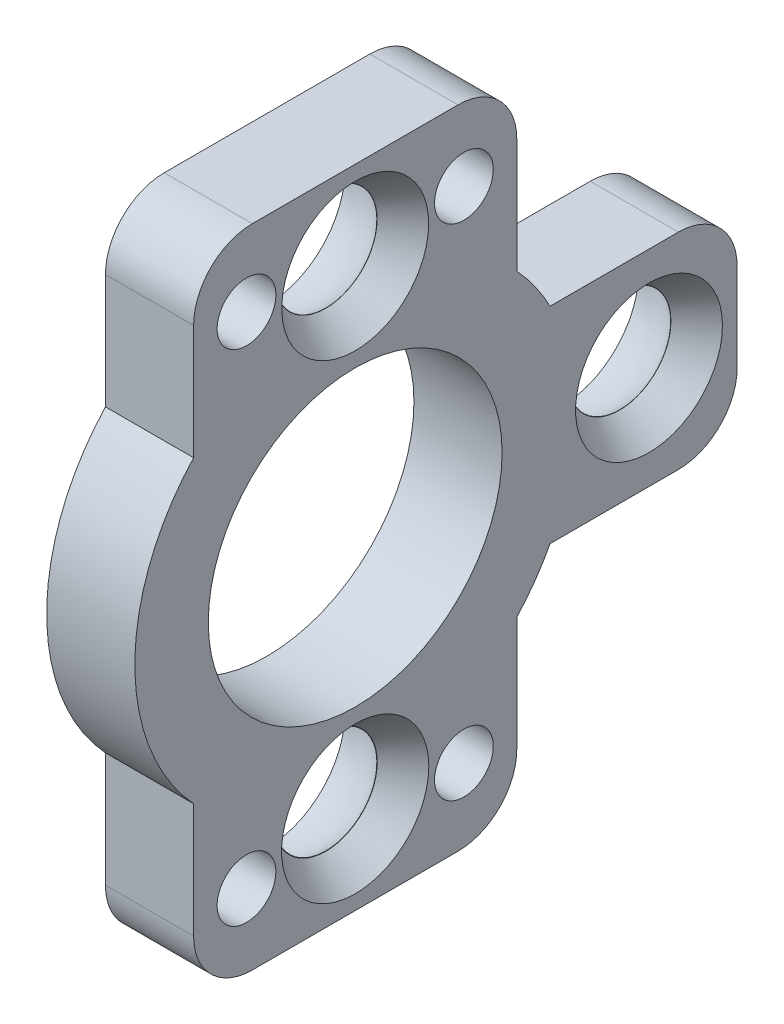
from build123d import *

# Parameters (mm, degrees)
SKETCH_1_R                    = 7.5
SKETCH_1_R_2                  = 5
EXTRUDE_1_DEPTH               = 3
SKETCH_2_W                    = 11
SKETCH_2_H                    = 6
EXTRUDE_2_DEPTH               = 3
SKETCH_5_R                    = 2.5
CUT_EXTRUDE_1_DEPTH           = 1
CUT_EXTRUDE_1_DRAFT           = -37
SKETCH_5_R_2                  = 2.505592327
CUT_EXTRUDE_1_PROFILE_2_DEPTH = 1
CUT_EXTRUDE_1_PROFILE_2_DRAFT = -37
FILLET_2_R                    = 2
SKETCH_7_R                    = 1
CUT_EXTRUDE_3_DEPTH           = 14.647344064
SKETCH_8_W                    = 7.5
SKETCH_8_H                    = 7
EXTRUDE_3_DEPTH               = 3
SKETCH_10_R                   = 2.5
CUT_EXTRUDE_4_DEPTH           = 1
CUT_EXTRUDE_4_DRAFT           = -37
FILLET_3_R                    = 2


with BuildPart() as part:
    # 草图1 → 凸台-拉伸1 (new body)
    with BuildSketch(Plane(origin=(0, 0, 0), x_dir=(0, 0, -1), z_dir=(1, 0, 0))):
        Circle(SKETCH_1_R)
        Circle(SKETCH_1_R_2, mode=Mode.SUBTRACT)
    extrude(amount=EXTRUDE_1_DEPTH)

    # 草图2 → 凸台-拉伸2 (add)
    with BuildSketch(Plane(origin=(3, 0, 0), x_dir=(0, 0, -1), z_dir=(1, 0, 0))):
        with Locations((0, 8)):
            Rectangle(SKETCH_2_W, SKETCH_2_H)
        with Locations((0, -8)):
            Rectangle(SKETCH_2_W, SKETCH_2_H)
    extrude(amount=-EXTRUDE_2_DEPTH)

    # 草图3 → 切除-旋转1 (revolve, cut)
    with BuildSketch(Plane.ZY):
        with BuildLine():
            Line((-2.65, 8), (2.65, 8))
            ThreePointArc((2.65, 8), (0, 5.35), (-2.65, 8))
        make_face()
    revolve(axis=Axis((0, 8, -2.65), (0, 0, 1)), mode=Mode.SUBTRACT)

    # 草图4 → 切除-旋转2 (revolve, cut)
    with BuildSketch(Plane.ZY):
        with BuildLine():
            Line((2.65, -8), (-2.65, -8))
            ThreePointArc((-2.65, -8), (0, -10.65), (2.65, -8))
        make_face()
    revolve(axis=Axis((0, -8, 2.65), (0, 0, -1)), mode=Mode.SUBTRACT)


with BuildPart() as cut_extrude_1_tool:
    # 草图5 → 切除-拉伸1 (with draft: the straight prism first)
    with BuildSketch(Plane(origin=(3, 0, 0), x_dir=(0, 0, -1), z_dir=(1, 0, 0))):
        with Locations((0, 8)):
            Circle(SKETCH_5_R)
    extrude(amount=-CUT_EXTRUDE_1_DEPTH)
    # 切除-拉伸1: the draft: its side faces are tilted about the plane it starts from
    cut_extrude_1_sides = [cut_extrude_1_tool.faces().sort_by_distance(p)[0] for p in [
        (2.5, 8, 2.5),
    ]]
    draft(cut_extrude_1_sides, Plane(origin=(3, 0, 0), x_dir=(0, 0, -1), z_dir=(1, 0, 0)), CUT_EXTRUDE_1_DRAFT)


with BuildPart() as part_1:
    add(part.part)

    # 切除-拉伸1: cut by cut_extrude_1_tool
    add(cut_extrude_1_tool.part, mode=Mode.SUBTRACT)


with BuildPart() as cut_extrude_1_profile_2_tool:
    # 草图5 → 切除-拉伸1 profile 2 (with draft: the straight prism first)
    with BuildSketch(Plane(origin=(3, 0, 0), x_dir=(0, 0, -1), z_dir=(1, 0, 0))):
        with Locations((0, -8)):
            Circle(SKETCH_5_R_2)
    extrude(amount=-CUT_EXTRUDE_1_PROFILE_2_DEPTH)
    # 切除-拉伸1 profile 2: the draft: its side faces are tilted about the plane it starts from
    cut_extrude_1_profile_2_sides = [cut_extrude_1_profile_2_tool.faces().sort_by_distance(p)[0] for p in [
        (2.5, -8, 2.505592327),
    ]]
    draft(cut_extrude_1_profile_2_sides, Plane(origin=(3, 0, 0), x_dir=(0, 0, -1), z_dir=(1, 0, 0)), CUT_EXTRUDE_1_PROFILE_2_DRAFT)


with BuildPart() as part_2:
    add(part_1.part)

    # 切除-拉伸1 profile 2: cut by cut_extrude_1_profile_2_tool
    add(cut_extrude_1_profile_2_tool.part, mode=Mode.SUBTRACT)

    # 圆角2
    fillet_2_edges = [part_2.edges().sort_by_distance(p)[0] for p in [
        (1.5, 11, -5.5),
        (1.5, 11, 5.5),
        (1.5, -11, 5.5),
        (1.5, -11, -5.5),
    ]]
    fillet(fillet_2_edges, radius=FILLET_2_R)

    # 草图7 → 切除-拉伸3 (cut, through all)
    with BuildSketch(Plane(origin=(3, 0, 0), x_dir=(0, 0, -1), z_dir=(1, 0, 0))):
        with Locations((-3.7, -8.5)):
            Circle(SKETCH_7_R)
        with Locations(Location((3.7, -8.5, 0), (0, 0, 180))):
            Circle(SKETCH_7_R)
        with Locations((3.7, 8.5)):
            Circle(SKETCH_7_R)
        with Locations(Location((-3.7, 8.5, 0), (0, 0, 180))):
            Circle(SKETCH_7_R)
    extrude(amount=-CUT_EXTRUDE_3_DEPTH, mode=Mode.SUBTRACT)

    # 草图8 → 凸台-拉伸3 (add)
    with BuildSketch(Plane.ZY):
        with Locations((-9.25, 0)):
            Rectangle(SKETCH_8_W, SKETCH_8_H)
    extrude(amount=-EXTRUDE_3_DEPTH)

    # 草图9 → 切除-旋转3 (revolve, cut)
    with BuildSketch(Plane.ZY):
        with BuildLine():
            Line((-7.35, 0), (-12.65, 0))
            ThreePointArc((-12.65, 0), (-10, 2.65), (-7.35, 0))
        make_face()
    revolve(axis=Axis((0, 0, -7.35), (0, 0, -1)), mode=Mode.SUBTRACT)


with BuildPart() as cut_extrude_4_tool:
    # 草图10 → 切除-拉伸4 (with draft: the straight prism first)
    with BuildSketch(Plane(origin=(3, 0, 0), x_dir=(0, 0, -1), z_dir=(1, 0, 0))):
        with Locations((10, 0)):
            Circle(SKETCH_10_R)
    extrude(amount=-CUT_EXTRUDE_4_DEPTH)
    # 切除-拉伸4: the draft: its side faces are tilted about the plane it starts from
    cut_extrude_4_sides = [cut_extrude_4_tool.faces().sort_by_distance(p)[0] for p in [
        (2.5, 0, -7.5),
    ]]
    draft(cut_extrude_4_sides, Plane(origin=(3, 0, 0), x_dir=(0, 0, -1), z_dir=(1, 0, 0)), CUT_EXTRUDE_4_DRAFT)


with BuildPart() as part_3:
    add(part_2.part)

    # 切除-拉伸4: cut by cut_extrude_4_tool
    add(cut_extrude_4_tool.part, mode=Mode.SUBTRACT)

    # 圆角3
    fillet_3_edges = [part_3.edges().sort_by_distance(p)[0] for p in [
        (1.5, 3.5, -13),
        (1.5, -3.5, -13),
    ]]
    fillet(fillet_3_edges, radius=FILLET_3_R)


solid = part_3.part
